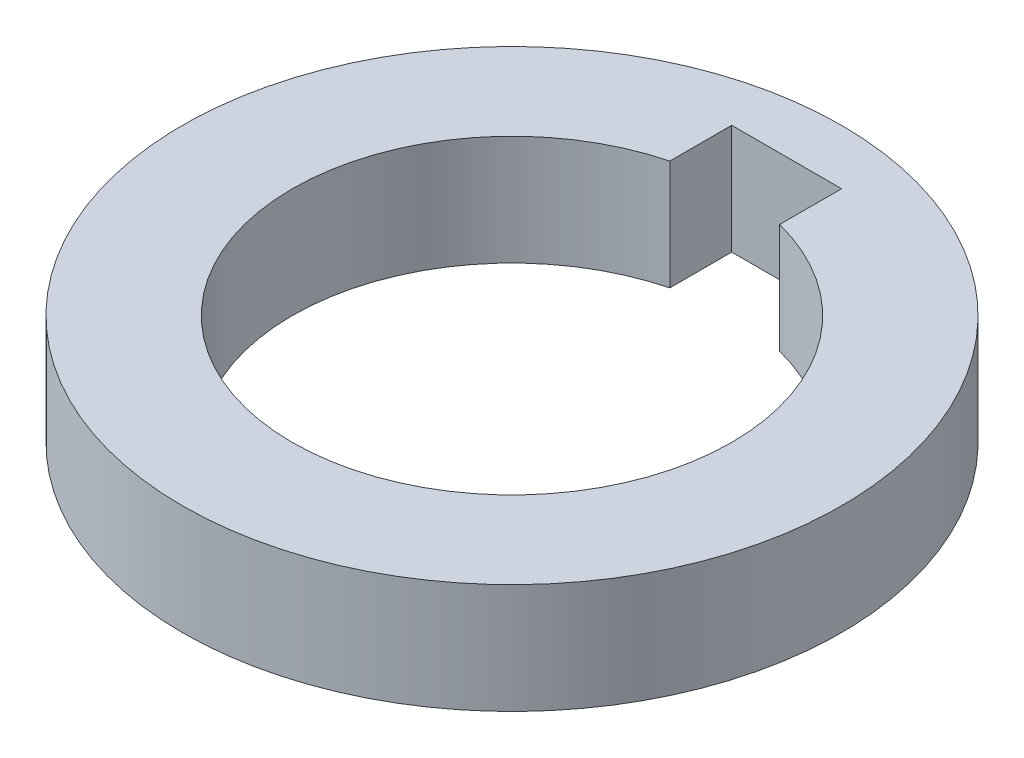
from build123d import *

# Parameters (mm, degrees)
SKETCH1_R           = 9.525
BOSS_EXTRUDE1_DEPTH = 3.175


with BuildPart() as part:
    # Sketch1 → Boss-Extrude1 (new body)
    with BuildSketch(Plane(origin=(0, 0, 0), x_dir=(1, 0, 0), z_dir=(0, 1, 0))):
        with Locations(Location((0, 0, 0), (0, 0, 270))):
            Circle(SKETCH1_R)
        with BuildLine():
            Line((-1.5875, 6.148361062), (-1.5875, 7.9375))
            Line((-1.5875, 7.9375), (1.5875, 7.9375))
            Line((1.5875, 7.9375), (1.5875, 6.148361062))
            ThreePointArc((1.5875, 6.148361062), (0, -6.35), (-1.5875, 6.148361062))
        make_face(mode=Mode.SUBTRACT)
    extrude(amount=BOSS_EXTRUDE1_DEPTH)


solid = part.part
